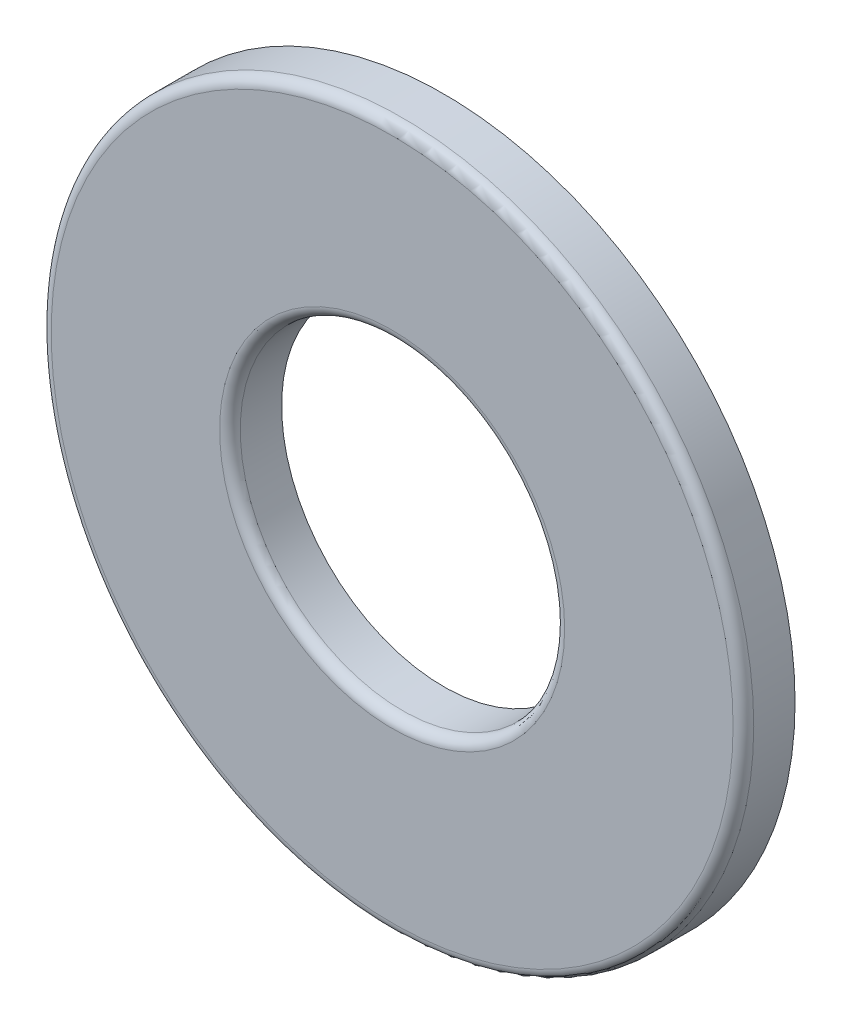
from build123d import *

# Parameters (mm, degrees)
SKETCH1_R           = 3.4
SKETCH1_R_2         = 1.57
BOSS_EXTRUDE1_DEPTH = 0.5
FILLET1_R           = 0.1


with BuildPart() as part:
    # Sketch1 → Boss-Extrude1 (new body)
    with BuildSketch(Plane.XY):
        Circle(SKETCH1_R)
        Circle(SKETCH1_R_2, mode=Mode.SUBTRACT)
    extrude(amount=BOSS_EXTRUDE1_DEPTH)

    # Fillet1
    fillet1_edges = [part.edges().sort_by_distance(p)[0] for p in [
        (-3.4, 0, 0.5),
        (-1.57, 0, 0.5),
    ]]
    fillet(fillet1_edges, radius=FILLET1_R)


solid = part.part
